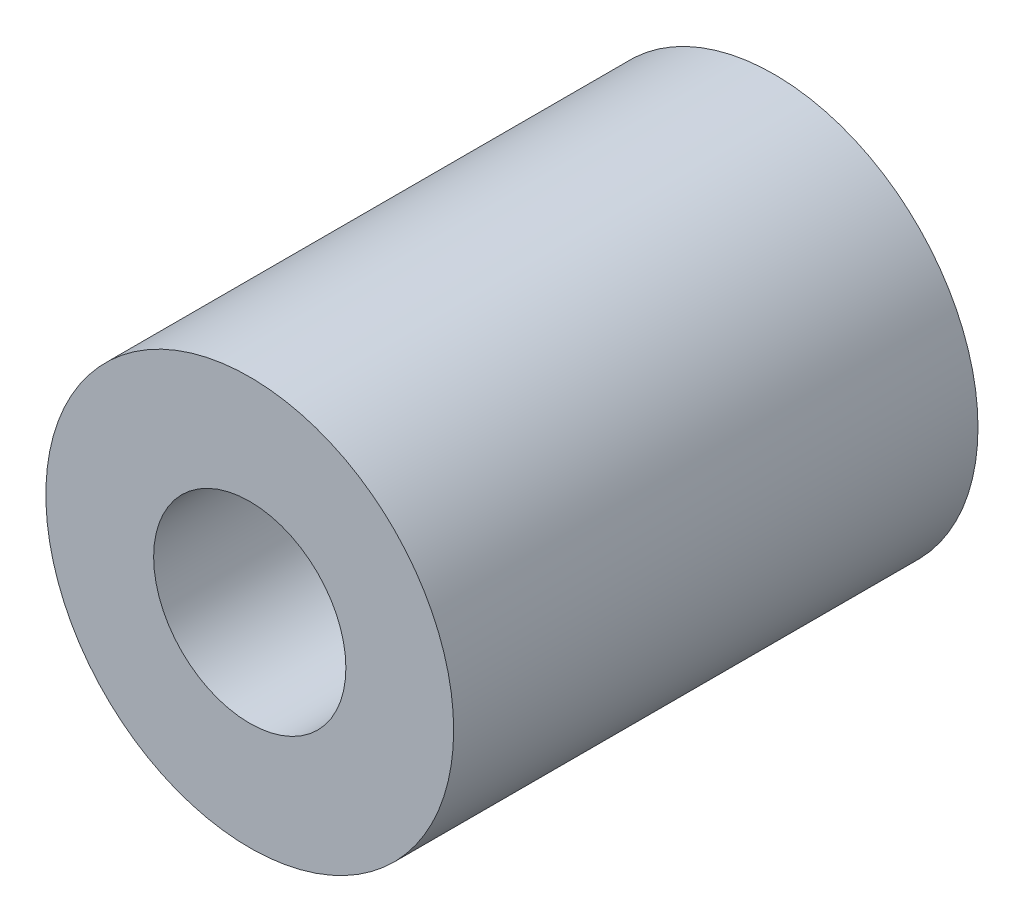
from build123d import *

# Parameters (mm, degrees)
SKETCH_1_R         = 3.5
EXTRUDE_1_DEPTH    = 9
HOLE_WIZARD_M4_1_D = 3.3


with BuildPart() as part:
    # 草图1 → 凸台-拉伸1 (new body)
    with BuildSketch(Plane.XY):
        Circle(SKETCH_1_R)
    extrude(amount=EXTRUDE_1_DEPTH)

    # M4 螺纹孔1 (through all)
    with Locations(Plane.XY.offset(9)):
        with Locations((0, 0)):
            Hole(HOLE_WIZARD_M4_1_D / 2)


solid = part.part
